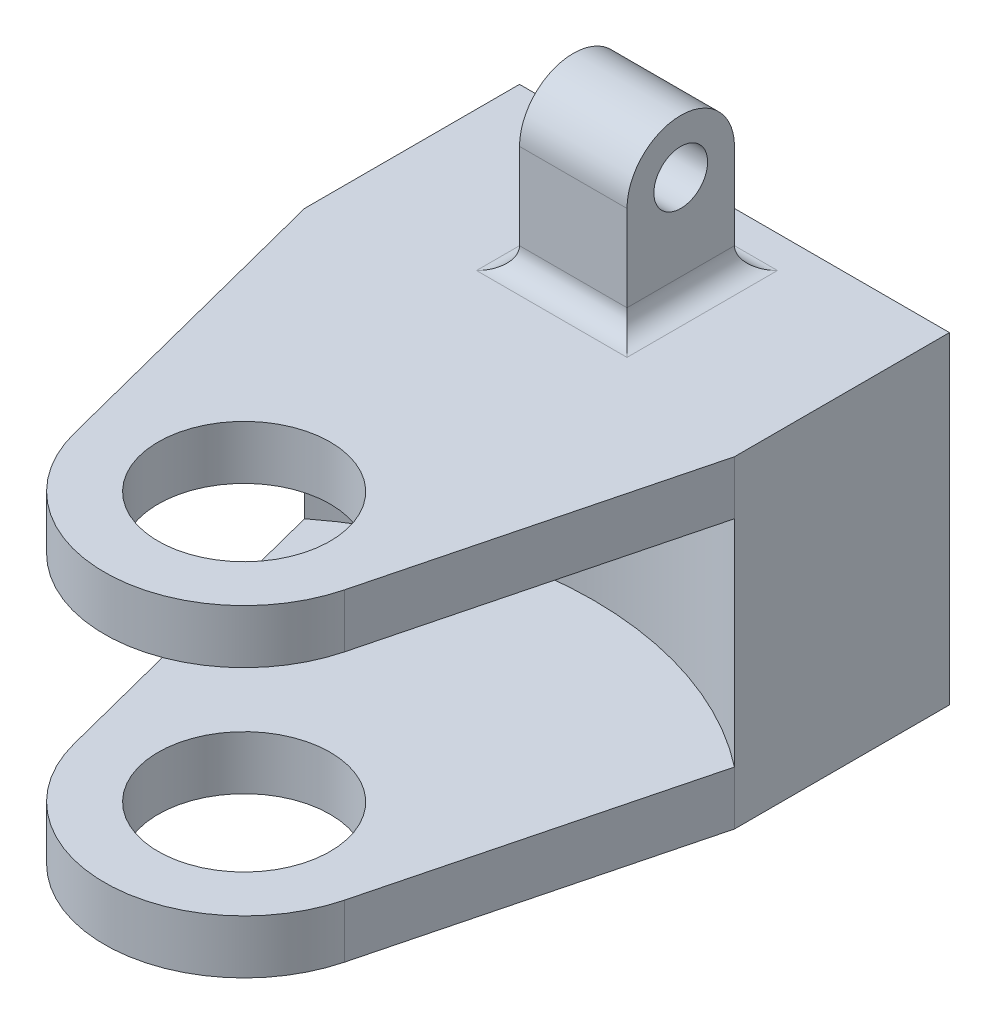
from build123d import *

# Parameters (mm, degrees)
SKETCH1_R                = 10.16
BOSS_EXTRUDE1_DEPTH      = 38.1
CUT_EXTRUDE1_START       = 6.35
SKETCH1_3_R              = 10.16
CUT_EXTRUDE1_DEPTH       = 25.4
BOSS_EXTRUDE2_DEPTH      = 6.35
BOSS_EXTRUDE2_DEPTH_BACK = 6.35
SKETCH3_R                = 3.175
BOSS_EXTRUDE3_START      = 6.35
SKETCH4_R                = 3.175
BOSS_EXTRUDE3_DEPTH      = 6.35
BOSS_EXTRUDE4_START      = -12.7
SKETCH4_3_R              = 3.175
BOSS_EXTRUDE4_DEPTH      = 6.35
FILLET1_R                = 2.54


with BuildPart() as part:
    # Sketch1 → Boss-Extrude1 (new body)
    with BuildSketch(Plane(origin=(0, 0, 0), x_dir=(1, 0, 0), z_dir=(0, 1, 0))):
        with BuildLine():
            Line((15.991186592, -4.106342823), (25.4, 32.534068682))
            Line((25.4, 32.534068682), (25.4, 57.934068682))
            Line((25.4, 57.934068682), (-25.4, 57.934068682))
            Line((-25.4, 57.934068682), (-25.4, 32.534068682))
            Line((-25.4, 32.534068682), (-15.991186592, -4.106342823))
            ThreePointArc((-15.991186592, -4.106342823), (0, -16.51), (15.991186592, -4.106342823))
        make_face()
        Circle(SKETCH1_R, mode=Mode.SUBTRACT)
    extrude(amount=BOSS_EXTRUDE1_DEPTH)

    # Sketch1<3> → Cut-Extrude1 (cut)
    with BuildSketch(Plane(origin=(0, 0, 0), x_dir=(1, 0, 0), z_dir=(0, 1, 0)).offset(CUT_EXTRUDE1_START)):
        with BuildLine():
            Line((15.991186592, -4.106342823), (25.4, 32.534068682))
            ThreePointArc((25.4, 32.534068682), (0, 41.275), (-25.4, 32.534068682))
            Line((-25.4, 32.534068682), (-15.991186592, -4.106342823))
            ThreePointArc((-15.991186592, -4.106342823), (0, -16.51), (15.991186592, -4.106342823))
        make_face()
        Circle(SKETCH1_3_R, mode=Mode.SUBTRACT)
    extrude(amount=CUT_EXTRUDE1_DEPTH, mode=Mode.SUBTRACT)

    # Sketch3 → Boss-Extrude2 (add, two sides: drawn at the far end of the back side and taken through both)
    with BuildSketch(Plane.ZY.offset(-BOSS_EXTRUDE2_DEPTH_BACK)):
        with BuildLine():
            Line((-51.584068682, 38.1), (-38.884068682, 38.1))
            Line((-38.884068682, 38.1), (-38.884068682, 50.8))
            ThreePointArc((-38.884068682, 50.8), (-45.234068682, 57.15), (-51.584068682, 50.8))
            Line((-51.584068682, 50.8), (-51.584068682, 38.1))
        make_face()
        with Locations((-45.234068682, 50.8)):
            Circle(SKETCH3_R, mode=Mode.SUBTRACT)
    extrude(amount=BOSS_EXTRUDE2_DEPTH + BOSS_EXTRUDE2_DEPTH_BACK)

    # Sketch4 → Boss-Extrude3 (add)
    with BuildSketch(Plane.ZY.offset(BOSS_EXTRUDE3_START)):
        with BuildLine():
            Line((-57.934068682, 12.7), (-57.934068682, 25.4))
            Line((-57.934068682, 25.4), (-64.284068682, 25.4))
            ThreePointArc((-64.284068682, 25.4), (-70.634068682, 19.05), (-64.284068682, 12.7))
            Line((-64.284068682, 12.7), (-57.934068682, 12.7))
        make_face()
        with Locations((-64.284068682, 19.05)):
            Circle(SKETCH4_R, mode=Mode.SUBTRACT)
    extrude(amount=BOSS_EXTRUDE3_DEPTH)

    # Sketch4<3> → Boss-Extrude4 (add)
    with BuildSketch(Plane.ZY.offset(BOSS_EXTRUDE4_START)):
        with BuildLine():
            Line((-57.934068682, 12.7), (-57.934068682, 25.4))
            Line((-57.934068682, 25.4), (-64.284068682, 25.4))
            ThreePointArc((-64.284068682, 25.4), (-70.634068682, 19.05), (-64.284068682, 12.7))
            Line((-64.284068682, 12.7), (-57.934068682, 12.7))
        make_face()
        with Locations((-64.284068682, 19.05)):
            Circle(SKETCH4_3_R, mode=Mode.SUBTRACT)
    extrude(amount=BOSS_EXTRUDE4_DEPTH)

    # Fillet1
    fillet1_edges = [part.edges().sort_by_distance(p)[0] for p in [
        (9.525, 12.7, -57.934068682),
        (9.525, 25.4, -57.934068682),
        (-9.525, 12.7, -57.934068682),
        (-9.525, 25.4, -57.934068682),
        (6.35, 38.1, -45.234068682),
        (-6.35, 38.1, -45.234068682),
        (0, 38.1, -38.884068682),
        (0, 38.1, -51.584068682),
        (-6.35, 19.05, -57.934068682),
        (6.35, 19.05, -57.934068682),
    ]]
    fillet(fillet1_edges, radius=FILLET1_R)


solid = part.part
